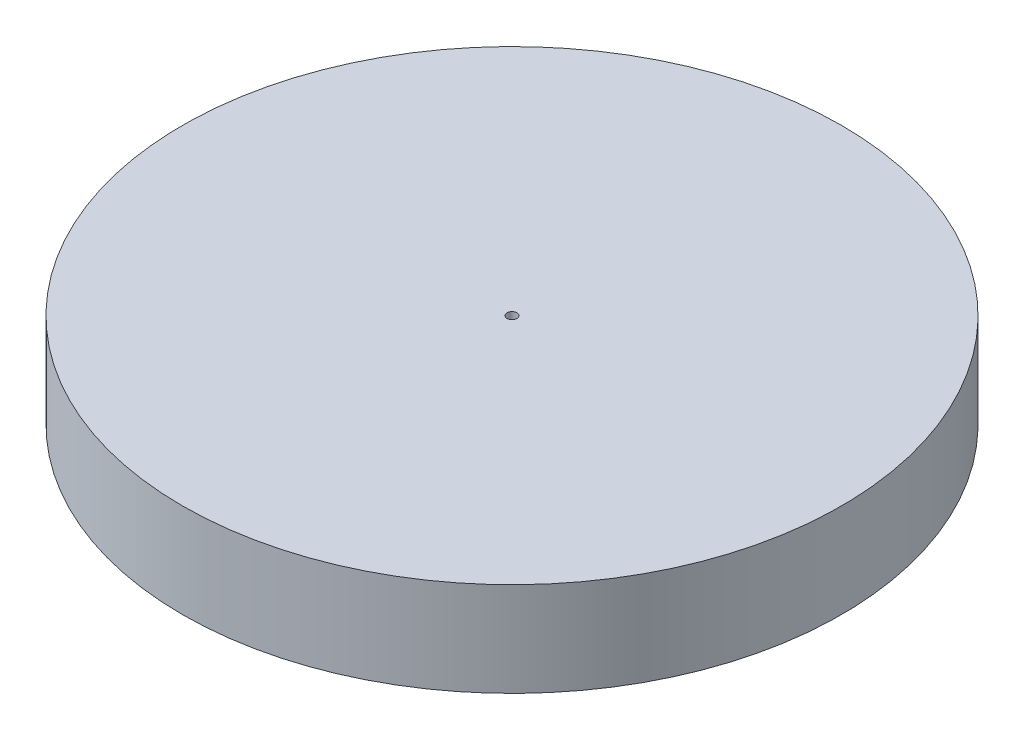
from build123d import *

# Parameters (mm, degrees)
SKETCH1_R      = 105
SKETCH1_R_2    = 1.575
EXTRUDE1_DEPTH = 30


with BuildPart() as part:
    # Sketch1 → Extrude1 (new body)
    with BuildSketch(Plane(origin=(0, 0, 0), x_dir=(1, 0, 0), z_dir=(0, 1, 0))):
        with Locations(Location((0, 0, 0), (0, 0, 270))):
            Circle(SKETCH1_R)
        with Locations(Location((0, 0, 0), (0, 0, 270))):
            Circle(SKETCH1_R_2, mode=Mode.SUBTRACT)
    extrude(amount=EXTRUDE1_DEPTH)


solid = part.part
